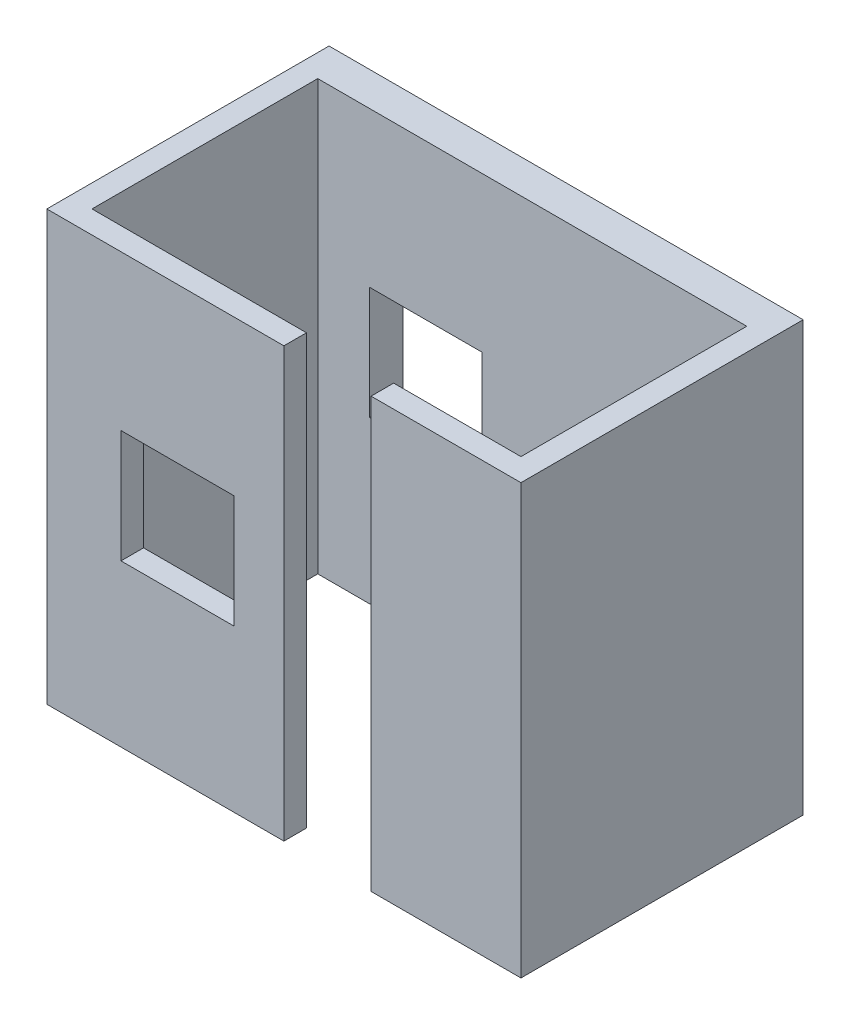
from build123d import *

# Parameters (mm, degrees)
SKETCH1_W                = 19
SKETCH1_H                = 19
BOSS_EXTRUDE1_DEPTH      = 1.5
SKETCH2_W                = 5
SKETCH2_H                = 5
CUT_EXTRUDE1_DEPTH       = 30.054329533
BOSS_EXTRUDE2_DEPTH      = 10
BOSS_EXTRUDE2_DEPTH_BACK = 1.5
SKETCH4_W                = 1
SKETCH4_H                = 19
SKETCH5_W                = 21
SKETCH5_H                = 1
BOSS_EXTRUDE3_DEPTH      = 19
SKETCH6_W                = 5
SKETCH6_H                = 5
CUT_EXTRUDE2_DEPTH       = 33.074717791
SKETCH7_W                = 3.862532253
SKETCH7_H                = 19
CUT_EXTRUDE3_DEPTH       = 1


with BuildPart() as part:
    # Sketch1 → Boss-Extrude1 (new body)
    with BuildSketch(Plane.XY):
        with Locations((-17.316728365, -1.580033592)):
            Rectangle(SKETCH1_W, SKETCH1_H)
    extrude(amount=BOSS_EXTRUDE1_DEPTH)

    # Sketch2 → Cut-Extrude1 (cut, through all)
    with BuildSketch(Plane(origin=(0, 0, 0), x_dir=(-1, 0, 0), z_dir=(0, 0, -1))):
        with Locations((22.031286711, -1.437353134)):
            Rectangle(SKETCH2_W, SKETCH2_H)
    extrude(amount=-CUT_EXTRUDE1_DEPTH, mode=Mode.SUBTRACT)

    # Sketch4 → Boss-Extrude2 (add, two sides: drawn at the far end of the back side and taken through both)
    with BuildSketch(Plane.XY.offset(1.5).offset(-BOSS_EXTRUDE2_DEPTH_BACK)):
        with Locations((-7.316728365, -1.580033592)):
            Rectangle(SKETCH4_W, SKETCH4_H)
        with Locations((-27.316728365, -1.580033592)):
            Rectangle(SKETCH4_W, SKETCH4_H)
    extrude(amount=BOSS_EXTRUDE2_DEPTH + BOSS_EXTRUDE2_DEPTH_BACK)

    # Sketch5 → Boss-Extrude3 (add)
    with BuildSketch(Plane(origin=(0, 7.919966408, 0), x_dir=(-1, 0, 0), z_dir=(0, 1, 0))):
        with Locations((17.316728365, 12)):
            Rectangle(SKETCH5_W, SKETCH5_H)
    extrude(amount=-BOSS_EXTRUDE3_DEPTH)

    # Sketch6 → Cut-Extrude2 (cut, through all)
    with BuildSketch(Plane(origin=(0, 0, 11.5), x_dir=(-1, 0, 0), z_dir=(0, 0, -1))):
        with Locations((22.031286711, -1.437353134)):
            Rectangle(SKETCH6_W, SKETCH6_H)
    extrude(amount=-CUT_EXTRUDE2_DEPTH, mode=Mode.SUBTRACT)

    # Sketch7 → Cut-Extrude3 (cut)
    with BuildSketch(Plane(origin=(0, 0, 12.5), x_dir=(-1, 0, 0), z_dir=(0, 0, -1))):
        with Locations((15.385462239, -1.580033592)):
            Rectangle(SKETCH7_W, SKETCH7_H)
    extrude(amount=CUT_EXTRUDE3_DEPTH, mode=Mode.SUBTRACT)


solid = part.part
